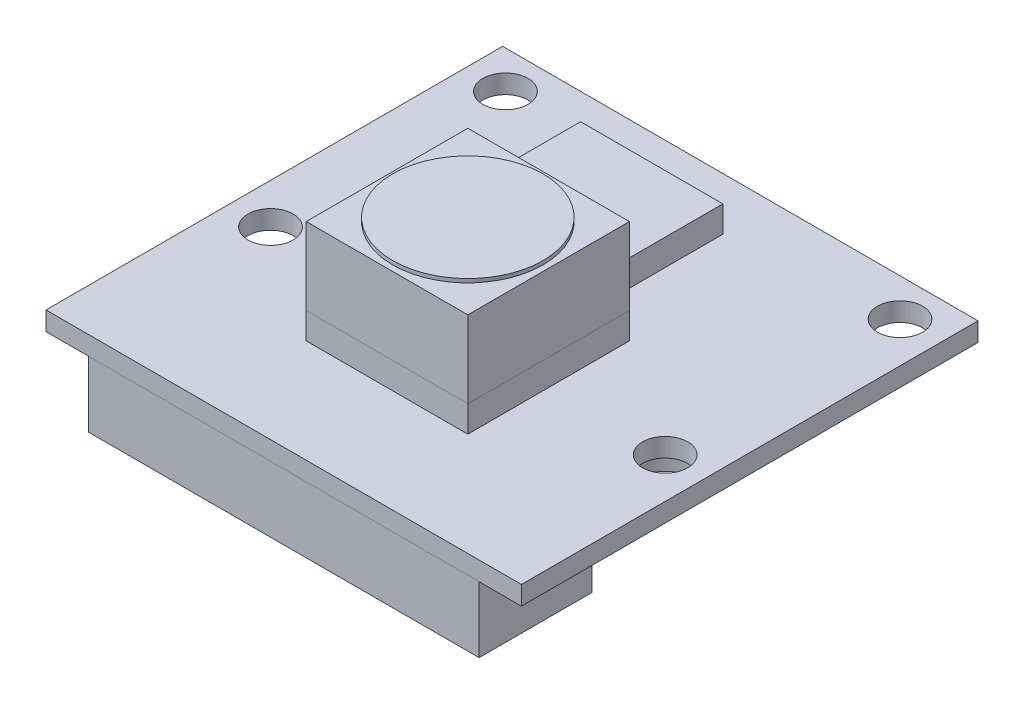
from build123d import *

# Parameters (mm, degrees)
ESQUISSE1_W        = 25.3
ESQUISSE1_H        = 24.3
BOSS_EXTRU_1_DEPTH = 1
D_GAGEMENT_M21_D   = 2.4
BOSS_EXTRU_2_DEPTH = 1.4
ESQUISSE5_W        = 8.6
ESQUISSE5_H        = 8.6
BOSS_EXTRU_3_DEPTH = 4.1
ESQUISSE6_R        = 4
BOSS_EXTRU_4_DEPTH = 0.2
ESQUISSE8_W        = 20.8
ESQUISSE8_H        = 6
BOSS_EXTRU_5_DEPTH = 3.5
BOSS_EXTRU_6_DEPTH = 1.5


with BuildPart() as part:
    # Esquisse1 → Boss.-Extru.1 (new body)
    with BuildSketch(Plane(origin=(0, 0, 0), x_dir=(1, 0, 0), z_dir=(0, 1, 0))):
        Rectangle(ESQUISSE1_W, ESQUISSE1_H)
    extrude(amount=BOSS_EXTRU_1_DEPTH)

    # Dégagement M21 (through all)
    with Locations(Plane(origin=(0, 1, 0), x_dir=(1, 0, 0), z_dir=(0, 1, 0))):
        with Locations((-10.5, 10.15), (10.5, 10.15), (-10.5, -2.35), (10.5, -2.35)):
            Hole(D_GAGEMENT_M21_D / 2)


with BuildPart() as body_2:
    # Esquisse4 → Boss.-Extru.2 (new body)
    with BuildSketch(Plane(origin=(0, 1, 0), x_dir=(1, 0, 0), z_dir=(0, 1, 0))):
        Polygon((-5.7, 9.35), (-5.7, 5.848572406), (-4.3, 5.848572406), (-4.3, -6.65), (4.3, -6.65), (4.3, 1.95), (1.870577592, 1.95), (1.870577592, 9.35), align=None)
    extrude(amount=BOSS_EXTRU_2_DEPTH)


with BuildPart() as body_3:
    # Esquisse5 → Boss.-Extru.3 (new body)
    with BuildSketch(Plane(origin=(0, 2.4, 0), x_dir=(1, 0, 0), z_dir=(0, 1, 0))):
        with Locations((0, -2.35)):
            Rectangle(ESQUISSE5_W, ESQUISSE5_H)
    extrude(amount=BOSS_EXTRU_3_DEPTH)


with BuildPart() as body_4:
    # Esquisse6 → Boss.-Extru.4 (new body)
    with BuildSketch(Plane(origin=(0, 6.5, 0), x_dir=(1, 0, 0), z_dir=(0, 1, 0))):
        with Locations(Location((0, -2.35, 0), (0, 0, 270))):
            Circle(ESQUISSE6_R)
    extrude(amount=BOSS_EXTRU_4_DEPTH)


with BuildPart() as body_5:
    # Esquisse8 → Boss.-Extru.5 (new body)
    with BuildSketch(Plane(origin=(0, 0, 0), x_dir=(-1, 0, 0), z_dir=(0, -1, 0))):
        with Locations((0, -9.15)):
            Rectangle(ESQUISSE8_W, ESQUISSE8_H)
    extrude(amount=BOSS_EXTRU_5_DEPTH)


with BuildPart() as body_6:
    # Esquisse9 → Boss.-Extru.6 (new body)
    with BuildSketch(Plane.XZ):
        with BuildLine():
            Line((-10.5, -0.1), (-10.5, -7.7))
            ThreePointArc((-10.5, -7.7), (-8.767588386, -8.417588386), (-8.05, -10.15))
            Line((-8.05, -10.15), (8.05, -10.15))
            ThreePointArc((8.05, -10.15), (8.767588386, -8.417588386), (10.5, -7.7))
            Line((10.5, -7.7), (10.5, -0.1))
            ThreePointArc((10.5, -0.1), (8.767588386, 0.617588386), (8.05, 2.35))
            Line((8.05, 2.35), (-8.05, 2.35))
            ThreePointArc((-8.05, 2.35), (-8.767588386, 0.617588386), (-10.5, -0.1))
        make_face()
    extrude(amount=BOSS_EXTRU_6_DEPTH)


solid = Compound([part.part, body_2.part, body_3.part, body_4.part, body_5.part, body_6.part])
